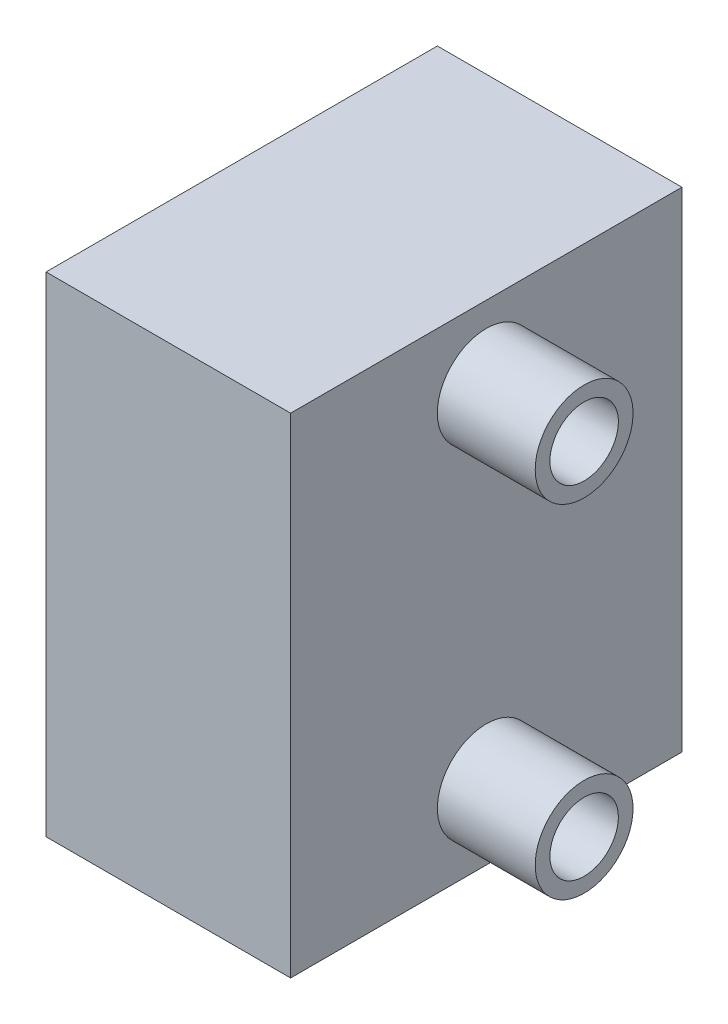
from build123d import *

# Parameters (mm, degrees)
SKETCH1_W           = 100
SKETCH1_H           = 80
BOSS_EXTRUDE1_DEPTH = 50
SKETCH2_R           = 10
SKETCH2_R_2         = 7
BOSS_EXTRUDE2_DEPTH = 20


with BuildPart() as part:
    # Sketch1 → Boss-Extrude1 (new body)
    with BuildSketch(Plane.YZ):
        Rectangle(SKETCH1_W, SKETCH1_H)
    extrude(amount=BOSS_EXTRUDE1_DEPTH)

    # Sketch2 → Boss-Extrude2 (add)
    # profile 1 of 2: a face of its own
    with BuildSketch(Plane.YZ.offset(50)):
        with Locations(Location((-35, 0, 0), (0, 0, 270))):
            Circle(SKETCH2_R)
        with Locations(Location((-35, 0, 0), (0, 0, 270))):
            Circle(SKETCH2_R_2, mode=Mode.SUBTRACT)
    # profile 2 of 2: a face of its own
    with BuildSketch(Plane.YZ.offset(50)):
        with Locations(Location((35, 0, 0), (0, 0, 90))):
            Circle(SKETCH2_R)
        with Locations(Location((35, 0, 0), (0, 0, 90))):
            Circle(SKETCH2_R_2, mode=Mode.SUBTRACT)
    extrude(amount=BOSS_EXTRUDE2_DEPTH)


solid = part.part
